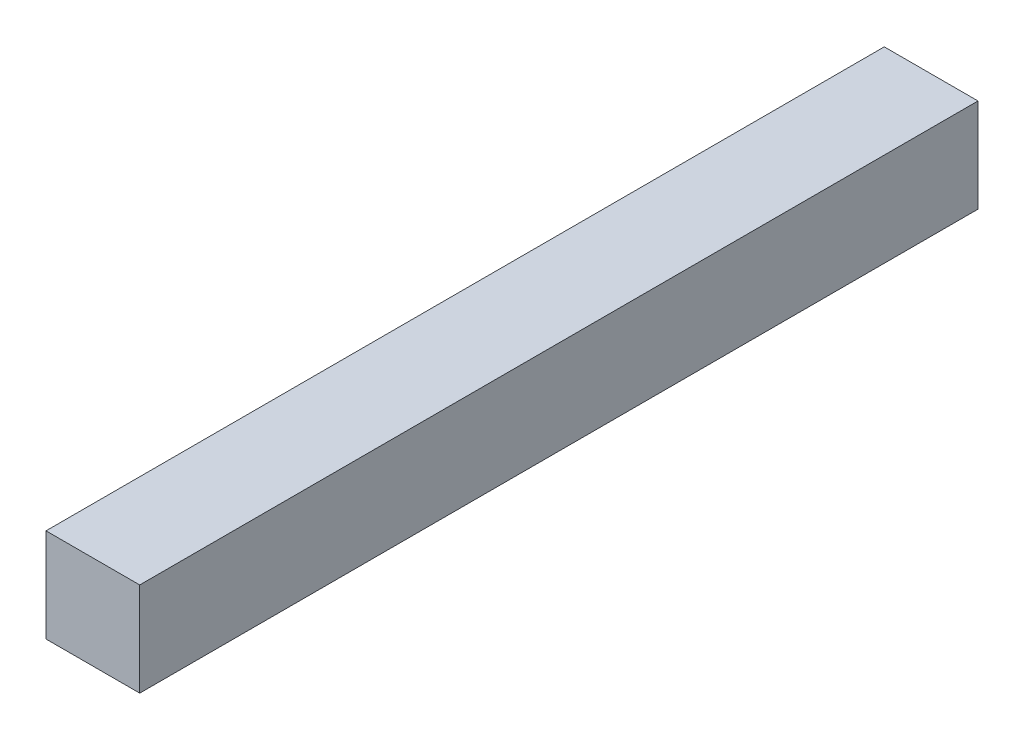
from build123d import *

# Parameters (mm, degrees)
SKETCH1_W           = 18
SKETCH1_H           = 18
BOSS_EXTRUDE1_DEPTH = 161


with BuildPart() as part:
    # Sketch1 → Boss-Extrude1 (new body)
    with BuildSketch(Plane.XY):
        with Locations((-80, -330)):
            Rectangle(SKETCH1_W, SKETCH1_H)
    extrude(amount=BOSS_EXTRUDE1_DEPTH)


solid = part.part
